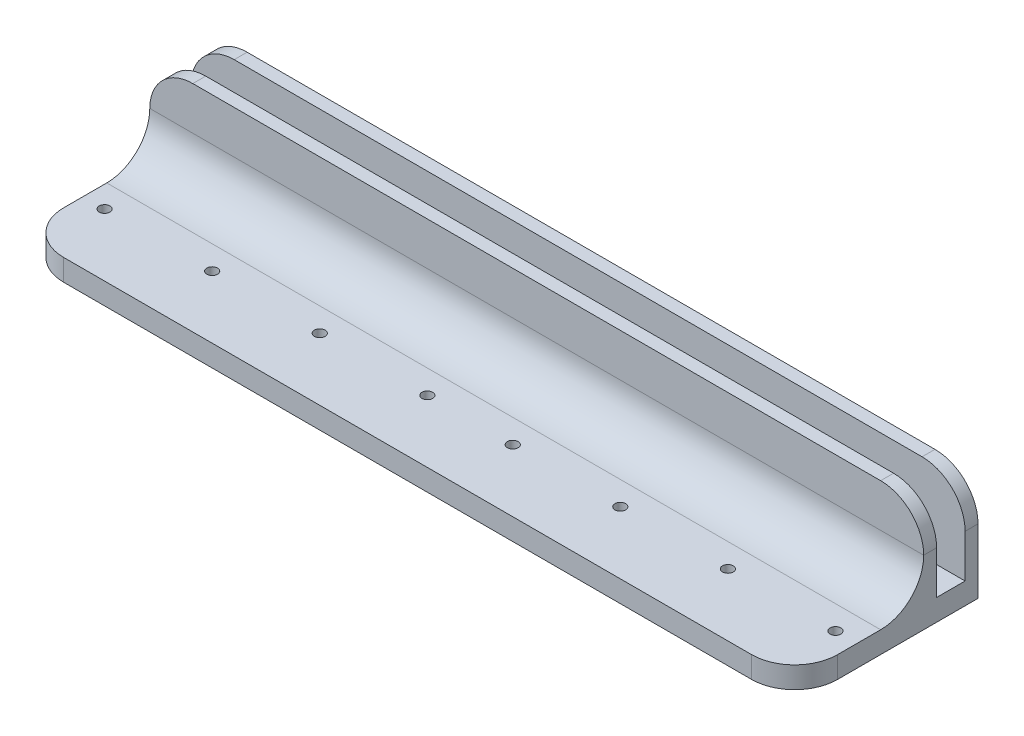
from build123d import *

# Parameters (mm, degrees)
SKETCH1_R           = 1.25
SKETCH1_W           = 179.84
SKETCH1_H           = 3
SKETCH1_H_2         = 6.62
BOSS_EXTRUDE1_DEPTH = 5
BOSS_EXTRUDE2_START = 5
SKETCH1_3_W         = 179.84
SKETCH1_3_H         = 3
BOSS_EXTRUDE2_DEPTH = 20
FILLET1_R           = 10
FILLET2_R           = 10


with BuildPart() as part:
    # Sketch1 → Boss-Extrude1 (new body)
    # profile 1 of 4: a face of its own
    with BuildSketch(Plane(origin=(0, 0, 0), x_dir=(1, 0, 0), z_dir=(0, 1, 0))):
        with BuildLine():
            Line((98.928888889, 12.527973461), (-80.911111111, 12.527973461))
            Line((-80.911111111, 12.527973461), (-80.911111111, -7.472026539))
            ThreePointArc((-80.911111111, -7.472026539), (-77.982178923, -14.543094351), (-70.911111111, -17.472026539))
            Line((-70.911111111, -17.472026539), (88.928888889, -17.472026539))
            ThreePointArc((88.928888889, -17.472026539), (95.999956701, -14.543094351), (98.928888889, -7.472026539))
            Line((98.928888889, -7.472026539), (98.928888889, 12.527973461))
        make_face()
        with Locations(Location((-75.911111111, -2.972026539, 0), (0, 0, 270))):
            Circle(SKETCH1_R, mode=Mode.SUBTRACT)
        with Locations(Location((-50.911111111, -2.972026539, 0), (0, 0, 270))):
            Circle(SKETCH1_R, mode=Mode.SUBTRACT)
        with Locations(Location((-25.911111111, -2.972026539, 0), (0, 0, 270))):
            Circle(SKETCH1_R, mode=Mode.SUBTRACT)
        with Locations(Location((-0.911111111, -2.972026539, 0), (0, 0, 270))):
            Circle(SKETCH1_R, mode=Mode.SUBTRACT)
        with Locations(Location((18.928888889, -2.972026539, 0), (0, 0, 270))):
            Circle(SKETCH1_R, mode=Mode.SUBTRACT)
        with Locations(Location((43.928888889, -2.972026539, 0), (0, 0, 270))):
            Circle(SKETCH1_R, mode=Mode.SUBTRACT)
        with Locations(Location((68.928888889, -2.972026539, 0), (0, 0, 270))):
            Circle(SKETCH1_R, mode=Mode.SUBTRACT)
        with Locations(Location((93.928888889, -2.972026539, 0), (0, 0, 270))):
            Circle(SKETCH1_R, mode=Mode.SUBTRACT)
    # profile 2 of 4: a face of its own
    with BuildSketch(Plane(origin=(0, 0, 0), x_dir=(1, 0, 0), z_dir=(0, 1, 0))):
        with Locations((9.008888889, 14.027973461)):
            Rectangle(SKETCH1_W, SKETCH1_H)
    # profile 3 of 4: a face of its own
    with BuildSketch(Plane(origin=(0, 0, 0), x_dir=(1, 0, 0), z_dir=(0, 1, 0))):
        with Locations((9.008888889, 18.837973461)):
            Rectangle(SKETCH1_W, SKETCH1_H_2)
    # profile 4 of 4: a face of its own
    with BuildSketch(Plane(origin=(0, 0, 0), x_dir=(1, 0, 0), z_dir=(0, 1, 0))):
        with Locations((9.008888889, 23.647973461)):
            Rectangle(SKETCH1_W, SKETCH1_H)
    extrude(amount=BOSS_EXTRUDE1_DEPTH)

    # Sketch1<3> → Boss-Extrude2 (add)
    with BuildSketch(Plane(origin=(0, 0, 0), x_dir=(1, 0, 0), z_dir=(0, 1, 0)).offset(BOSS_EXTRUDE2_START)):
        with Locations((9.008888889, 14.027973461)):
            Rectangle(SKETCH1_3_W, SKETCH1_3_H)
        with Locations((9.008888889, 23.647973461)):
            Rectangle(SKETCH1_3_W, SKETCH1_3_H)
    extrude(amount=BOSS_EXTRUDE2_DEPTH)

    # Fillet1
    fillet1_edges = [part.edges().sort_by_distance(p)[0] for p in [
        (9.008888889, 5, -12.527973461),
    ]]
    fillet(fillet1_edges, radius=FILLET1_R)

    # Fillet2
    fillet2_edges = [part.edges().sort_by_distance(p)[0] for p in [
        (-80.911111111, 25, -23.647973461),
        (-80.911111111, 25, -14.027973461),
        (98.928888889, 25, -14.027973461),
        (98.928888889, 25, -23.647973461),
    ]]
    fillet(fillet2_edges, radius=FILLET2_R)


solid = part.part
